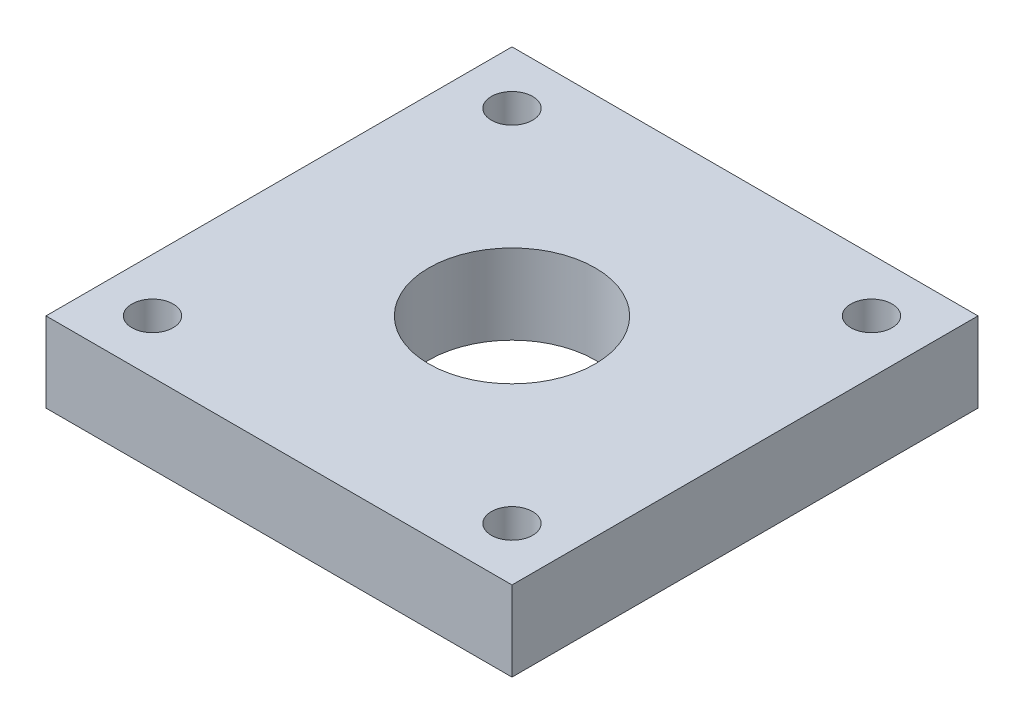
from build123d import *

# Parameters (mm, degrees)
SKETCH1_W            = 35
SKETCH1_H            = 35
SKETCH1_R            = 6.25
BOSS_EXTRUDE1_DEPTH  = 6
M3_CLEARANCE_HOLE1_D = 3.1


with BuildPart() as part:
    # Sketch1 → Boss-Extrude1 (new body)
    with BuildSketch(Plane(origin=(0, 0, 0), x_dir=(1, 0, 0), z_dir=(0, 1, 0))):
        Rectangle(SKETCH1_W, SKETCH1_H)
        with Locations(Location((0, 0, 0), (0, 0, 270))):
            Circle(SKETCH1_R, mode=Mode.SUBTRACT)
    extrude(amount=BOSS_EXTRUDE1_DEPTH)

    # M3 Clearance Hole1 (through all)
    with Locations(Plane(origin=(0, 6, 0), x_dir=(1, 0, 0), z_dir=(0, 1, 0))):
        with Locations((-13.5, 13.5), (13.5, 13.5), (13.5, -13.5), (-13.5, -13.5), (0, 0)):
            Hole(M3_CLEARANCE_HOLE1_D / 2)


solid = part.part
